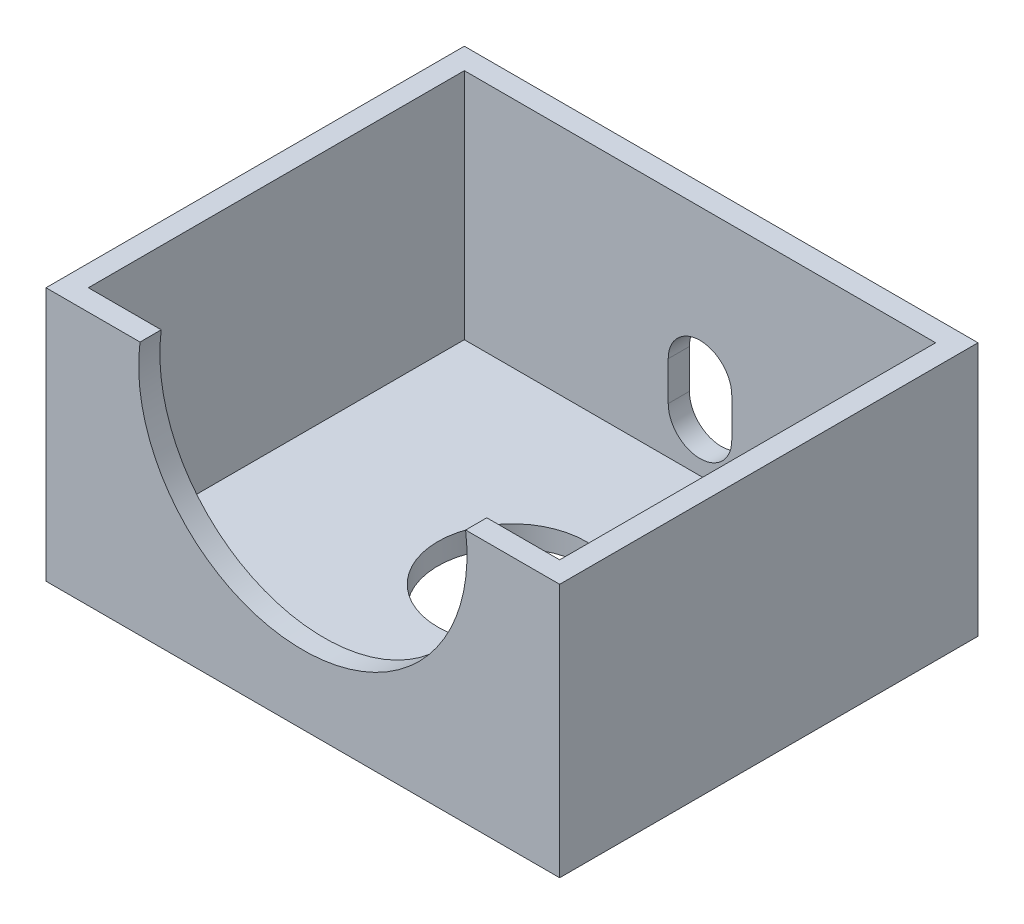
from build123d import *

# Parameters (mm, degrees)
SKETCH_2_W          = 48.5
SKETCH_2_H          = 39.5
EXTRUDE_1_DEPTH     = 2
SKETCH_4_W          = 48.5
SKETCH_4_H          = 39.5
SKETCH_4_W_2        = 44.5
SKETCH_4_H_2        = 35.5
EXTRUDE_2_DEPTH     = 22
SKETCH_5_R          = 15.5
CUT_EXTRUDE_1_DEPTH = 10
CUT_EXTRUDE_2_DEPTH = 10
SKETCH_7_R          = 7
CUT_EXTRUDE_3_DEPTH = 10


with BuildPart() as part:
    # 草图2 → 凸台-拉伸1 (new body)
    with BuildSketch(Plane(origin=(0, 0, 0), x_dir=(1, 0, 0), z_dir=(0, 1, 0))):
        Rectangle(SKETCH_2_W, SKETCH_2_H)
    extrude(amount=EXTRUDE_1_DEPTH)

    # 草图4 → 凸台-拉伸2 (add)
    with BuildSketch(Plane(origin=(0, 2, 0), x_dir=(1, 0, 0), z_dir=(0, 1, 0))):
        Rectangle(SKETCH_4_W, SKETCH_4_H)
        Rectangle(SKETCH_4_W_2, SKETCH_4_H_2, mode=Mode.SUBTRACT)
    extrude(amount=EXTRUDE_2_DEPTH)

    # 草图5 → 切除-拉伸1 (cut)
    with BuildSketch(Plane.XY.offset(19.75)):
        with Locations((0, 22)):
            Circle(SKETCH_5_R)
    extrude(amount=-CUT_EXTRUDE_1_DEPTH, mode=Mode.SUBTRACT)

    # 草图6 → 切除-拉伸2 (cut)
    with BuildSketch(Plane(origin=(0, 0, -19.75), x_dir=(-1, 0, 0), z_dir=(0, 0, -1))):
        with BuildLine():
            Line((3, 10.070876888), (3, 6.403632954))
            ThreePointArc((3, 6.403632954), (0, 3.403632954), (-3, 6.403632954))
            Line((-3, 6.403632954), (-3, 10.070876888))
            ThreePointArc((-3, 10.070876888), (0, 13.070876888), (3, 10.070876888))
        make_face()
    extrude(amount=-CUT_EXTRUDE_2_DEPTH, mode=Mode.SUBTRACT)

    # 草图7 → 切除-拉伸3 (cut)
    with BuildSketch(Plane.XZ):
        with Locations(Location((0, 0, 0), (0, 0, 270))):
            Circle(SKETCH_7_R)
    extrude(amount=-CUT_EXTRUDE_3_DEPTH, mode=Mode.SUBTRACT)


solid = part.part
